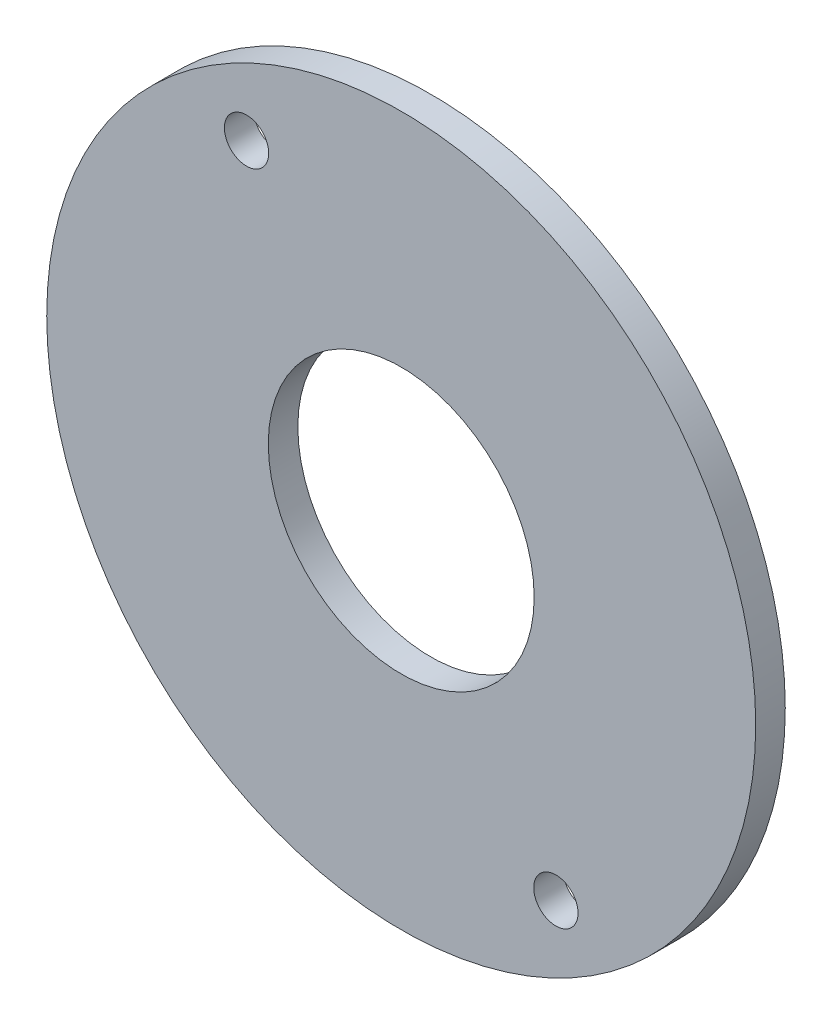
from build123d import *

# Parameters (mm, degrees)
SKETCH1_R           = 38.1
SKETCH1_R_2         = 14.2875
SKETCH1_R_3         = 2.38125
BOSS_EXTRUDE1_DEPTH = 3.175


with BuildPart() as part:
    # Sketch1 → Boss-Extrude1 (new body)
    with BuildSketch(Plane.XY):
        with Locations((136.607006946, 62.261815798)):
            Circle(SKETCH1_R)
        with Locations((136.607006946, 62.261815798)):
            Circle(SKETCH1_R_2, mode=Mode.SUBTRACT)
        with Locations((153.229489525, 35.2108348)):
            Circle(SKETCH1_R_3, mode=Mode.SUBTRACT)
        with Locations((119.984524367, 89.312796795)):
            Circle(SKETCH1_R_3, mode=Mode.SUBTRACT)
    extrude(amount=BOSS_EXTRUDE1_DEPTH)


solid = part.part
